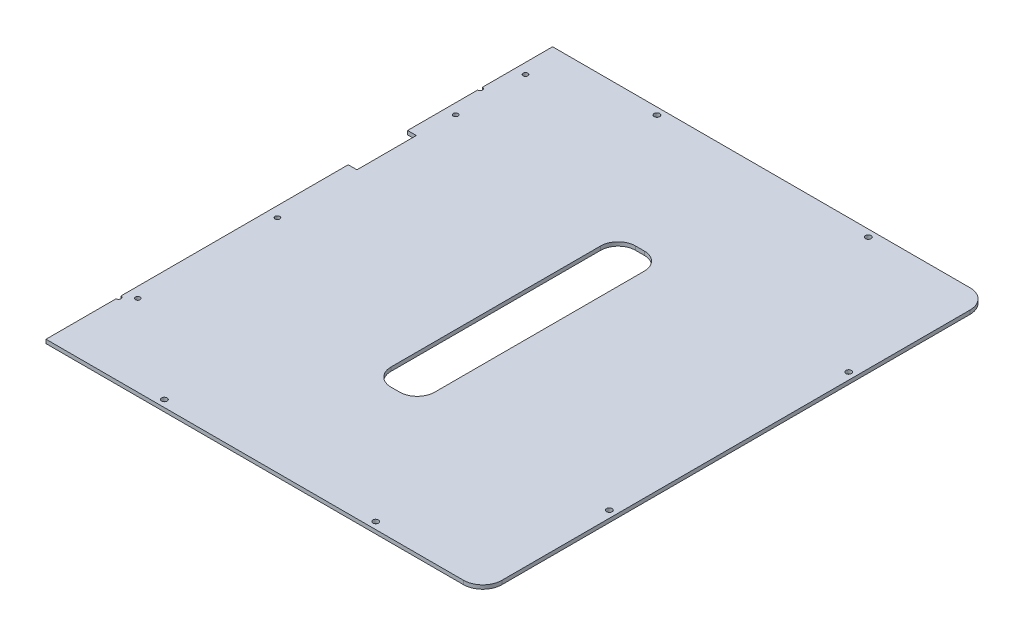
from build123d import *

# Parameters (mm, degrees)
SKETCH1_R           = 1.6
SKETCH1_R_2         = 1.4
SKETCH1_W           = 10
SKETCH1_H           = 34
BOSS_EXTRUDE1_DEPTH = 2.2
SKETCH2_R           = 1.35
CUT_EXTRUDE1_DEPTH  = 59.2
SKETCH4_W           = 292.714783979
SKETCH4_H           = 326.007375252
CUT_EXTRUDE2_DEPTH  = 2.2


with BuildPart() as part:
    # Sketch1 → Boss-Extrude1 (new body)
    with BuildSketch(Plane(origin=(0, 0, 0), x_dir=(1, 0, 0), z_dir=(0, 1, 0))):
        with BuildLine():
            Line((-239, 145), (239, 145))
            ThreePointArc((239, 145), (246.778174593, 141.778174593), (250, 134))
            Line((250, 134), (250, -134))
            ThreePointArc((250, -134), (246.778174593, -141.778174593), (239, -145))
            Line((239, -145), (-239, -145))
            ThreePointArc((-239, -145), (-246.778174593, -141.778174593), (-250, -134))
            Line((-250, -134), (-250, 134))
            ThreePointArc((-250, 134), (-246.778174593, 141.778174593), (-239, 145))
        make_face()
        with Locations(Location((63.75, 141, 0), (0, 0, 270))):
            Circle(SKETCH1_R, mode=Mode.SUBTRACT)
        with Locations(Location((184.75, 141, 0), (0, 0, 270))):
            Circle(SKETCH1_R, mode=Mode.SUBTRACT)
        with Locations(Location((246, 68.5, 0), (0, 0, 270))):
            Circle(SKETCH1_R, mode=Mode.SUBTRACT)
        with Locations(Location((0, 103.5, 0), (0, 0, 270))):
            Circle(SKETCH1_R_2, mode=Mode.SUBTRACT)
        with Locations(Location((0, -103.5, 0), (0, 0, 270))):
            Circle(SKETCH1_R_2, mode=Mode.SUBTRACT)
        with Locations(Location((-246, 68.5, 0), (0, 0, 90))):
            Circle(SKETCH1_R, mode=Mode.SUBTRACT)
        with Locations(Location((-184.75, 141, 0), (0, 0, 90))):
            Circle(SKETCH1_R, mode=Mode.SUBTRACT)
        with Locations(Location((-63.75, 141, 0), (0, 0, 90))):
            Circle(SKETCH1_R, mode=Mode.SUBTRACT)
        with Locations(Location((184.75, -141, 0), (0, 0, 90))):
            Circle(SKETCH1_R, mode=Mode.SUBTRACT)
        with Locations(Location((246, -68.5, 0), (0, 0, 90))):
            Circle(SKETCH1_R, mode=Mode.SUBTRACT)
        with Locations(Location((63.75, -141, 0), (0, 0, 90))):
            Circle(SKETCH1_R, mode=Mode.SUBTRACT)
        with Locations(Location((-63.75, -141, 0), (0, 0, 270))):
            Circle(SKETCH1_R, mode=Mode.SUBTRACT)
        with Locations(Location((-184.75, -141, 0), (0, 0, 270))):
            Circle(SKETCH1_R, mode=Mode.SUBTRACT)
        with Locations(Location((-246, -68.5, 0), (0, 0, 270))):
            Circle(SKETCH1_R, mode=Mode.SUBTRACT)
        with BuildLine():
            Line((-127.5, -70), (-122.5, -70))
            ThreePointArc((-122.5, -70), (-115.428932188, -67.071067812), (-112.5, -60))
            Line((-112.5, -60), (-112.5, 60))
            ThreePointArc((-112.5, 60), (-115.428932188, 67.071067812), (-122.5, 70))
            Line((-122.5, 70), (-127.5, 70))
            ThreePointArc((-127.5, 70), (-134.571067812, 67.071067812), (-137.5, 60))
            Line((-137.5, 60), (-137.5, -60))
            ThreePointArc((-137.5, -60), (-134.571067812, -67.071067812), (-127.5, -70))
        make_face(mode=Mode.SUBTRACT)
        with BuildLine():
            Line((122.5, -70), (127.5, -70))
            ThreePointArc((127.5, -70), (134.571067812, -67.071067812), (137.5, -60))
            Line((137.5, -60), (137.5, 60))
            ThreePointArc((137.5, 60), (134.571067812, 67.071067812), (127.5, 70))
            Line((127.5, 70), (122.5, 70))
            ThreePointArc((122.5, 70), (115.428932188, 67.071067812), (112.5, 60))
            Line((112.5, 60), (112.5, -60))
            ThreePointArc((112.5, -60), (115.428932188, -67.071067812), (122.5, -70))
        make_face(mode=Mode.SUBTRACT)
        with Locations((0, 45)):
            Rectangle(SKETCH1_W, SKETCH1_H, mode=Mode.SUBTRACT)
    extrude(amount=BOSS_EXTRUDE1_DEPTH)

    # Sketch2 → Cut-Extrude1 (cut)
    with BuildSketch(Plane(origin=(0, 2.2, 0), x_dir=(1, 0, 0), z_dir=(0, 1, 0))):
        with Locations(Location((-6, -18.5, 0), (0, 0, 270))):
            Circle(SKETCH2_R)
        with Locations(Location((6, -18.5, 0), (0, 0, 270))):
            Circle(SKETCH2_R)
        with Locations(Location((-6, -98.5, 0), (0, 0, 270))):
            Circle(SKETCH2_R)
        with Locations(Location((6, -98.5, 0), (0, 0, 270))):
            Circle(SKETCH2_R)
        with Locations(Location((-6, 123.5, 0), (0, 0, 270))):
            Circle(SKETCH2_R)
        with Locations(Location((6, 123.5, 0), (0, 0, 270))):
            Circle(SKETCH2_R)
        with Locations(Location((-6, 83.5, 0), (0, 0, 270))):
            Circle(SKETCH2_R)
        with Locations(Location((6, 83.5, 0), (0, 0, 270))):
            Circle(SKETCH2_R)
    extrude(amount=-CUT_EXTRUDE1_DEPTH, mode=Mode.SUBTRACT)

    # Sketch4 → Cut-Extrude2 (cut)
    with BuildSketch(Plane(origin=(0, 2.2, 0), x_dir=(1, 0, 0), z_dir=(0, 1, 0))):
        with Locations((-146.35739199, -18.003687626)):
            Rectangle(SKETCH4_W, SKETCH4_H)
    extrude(amount=-CUT_EXTRUDE2_DEPTH, mode=Mode.SUBTRACT)


solid = part.part
